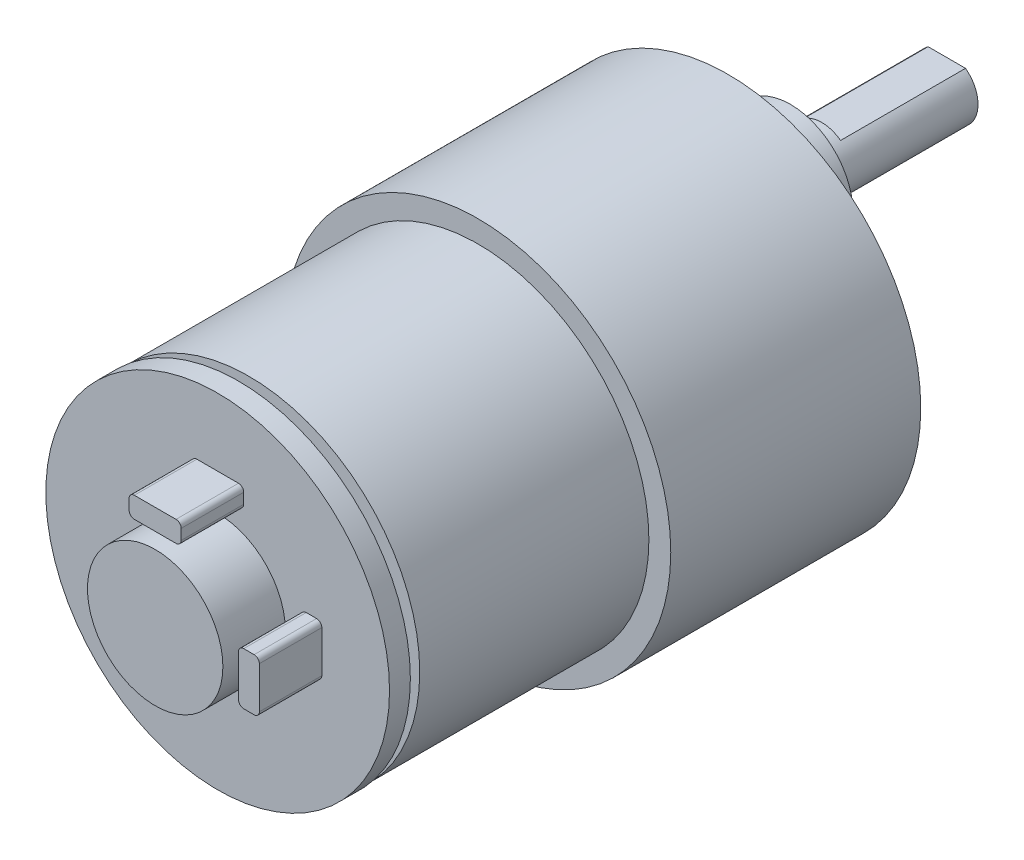
from build123d import *

# Parameters (mm, degrees)
SKETCH_1_R          = 18.5
EXTRUDE_1_DEPTH     = 24
SKETCH_1_3_R        = 1.5
CUT_EXTRUDE_1_DEPTH = 20
SKETCH_3_R          = 16.4
EXTRUDE_3_DEPTH     = 22
SKETCH_4_R          = 6
EXTRUDE_4_DEPTH     = 6
SKETCH_5_R          = 3
EXTRUDE_5_DEPTH     = 3
EXTRUDE_6_DEPTH     = 12
SKETCH_7_R          = 15
EXTRUDE_7_DEPTH     = 1
SKETCH_8_R          = 16.5
EXTRUDE_8_DEPTH     = 2
SKETCH_9_R          = 6.5
EXTRUDE_9_DEPTH     = 6


with BuildPart() as part:
    # 草图1 → 凸台-拉伸1 (new body)
    with BuildSketch(Plane.XY):
        Circle(SKETCH_1_R)
    extrude(amount=EXTRUDE_1_DEPTH)

    # 草图1<3> → 切除-拉伸1 (cut)
    with BuildSketch(Plane.XY):
        with Locations((-15.5, 0)):
            Circle(SKETCH_1_3_R)
        with Locations((-7.75, 13.423393759)):
            Circle(SKETCH_1_3_R)
        with Locations((-7.75, -13.423393759)):
            Circle(SKETCH_1_3_R)
        with Locations((7.75, 13.423393759)):
            Circle(SKETCH_1_3_R)
        with Locations((15.5, 0)):
            Circle(SKETCH_1_3_R)
        with Locations((7.75, -13.423393759)):
            Circle(SKETCH_1_3_R)
    extrude(amount=CUT_EXTRUDE_1_DEPTH, mode=Mode.SUBTRACT)

    # 草图3 → 凸台-拉伸3 (add)
    with BuildSketch(Plane.XY.offset(24)):
        Circle(SKETCH_3_R)
    extrude(amount=EXTRUDE_3_DEPTH)

    # 草图4 → 凸台-拉伸4 (add)
    with BuildSketch(Plane(origin=(0, 0, 0), x_dir=(-1, 0, 0), z_dir=(0, 0, -1))):
        with Locations(Location((0, 7, 0), (0, 0, 180))):
            Circle(SKETCH_4_R)
    extrude(amount=EXTRUDE_4_DEPTH)

    # 草图5 → 凸台-拉伸5 (add)
    with BuildSketch(Plane(origin=(0, 0, -6), x_dir=(-1, 0, 0), z_dir=(0, 0, -1))):
        with Locations((0, 7)):
            Circle(SKETCH_5_R)
    extrude(amount=EXTRUDE_5_DEPTH)

    # 草图6 → 凸台-拉伸6 (add)
    with BuildSketch(Plane(origin=(0, 0, -9), x_dir=(-1, 0, 0), z_dir=(0, 0, -1))):
        with BuildLine():
            Line((-1.8, 9.4), (1.8, 9.4))
            ThreePointArc((1.8, 9.4), (0, 4), (-1.8, 9.4))
        make_face()
    extrude(amount=EXTRUDE_6_DEPTH)

    # 草图7 → 凸台-拉伸7 (add)
    with BuildSketch(Plane.XY.offset(46)):
        Circle(SKETCH_7_R)
    extrude(amount=EXTRUDE_7_DEPTH)

    # 草图8 → 凸台-拉伸8 (add)
    with BuildSketch(Plane.XY.offset(47)):
        Circle(SKETCH_8_R)
    extrude(amount=EXTRUDE_8_DEPTH)

    # 草图9 → 凸台-拉伸9 (add)
    with BuildSketch(Plane.XY.offset(49)):
        Circle(SKETCH_9_R)
        with BuildLine():
            Line((-2, 10), (2, 10))
            ThreePointArc((2, 10), (2.353553391, 9.853553391), (2.5, 9.5))
            Line((2.5, 9.5), (2.5, 8.5))
            ThreePointArc((2.5, 8.5), (2.353553391, 8.146446609), (2, 8))
            Line((2, 8), (-2, 8))
            ThreePointArc((-2, 8), (-2.353553391, 8.146446609), (-2.5, 8.5))
            Line((-2.5, 8.5), (-2.5, 9.5))
            ThreePointArc((-2.5, 9.5), (-2.353553391, 9.853553391), (-2, 10))
        make_face()
        with BuildLine():
            Line((8.5, 2.5), (9.5, 2.5))
            ThreePointArc((9.5, 2.5), (9.853553391, 2.353553391), (10, 2))
            Line((10, 2), (10, -2))
            ThreePointArc((10, -2), (9.853553391, -2.353553391), (9.5, -2.5))
            Line((9.5, -2.5), (8.5, -2.5))
            ThreePointArc((8.5, -2.5), (8.146446609, -2.353553391), (8, -2))
            Line((8, -2), (8, 2))
            ThreePointArc((8, 2), (8.146446609, 2.353553391), (8.5, 2.5))
        make_face()
    extrude(amount=EXTRUDE_9_DEPTH)


solid = part.part
